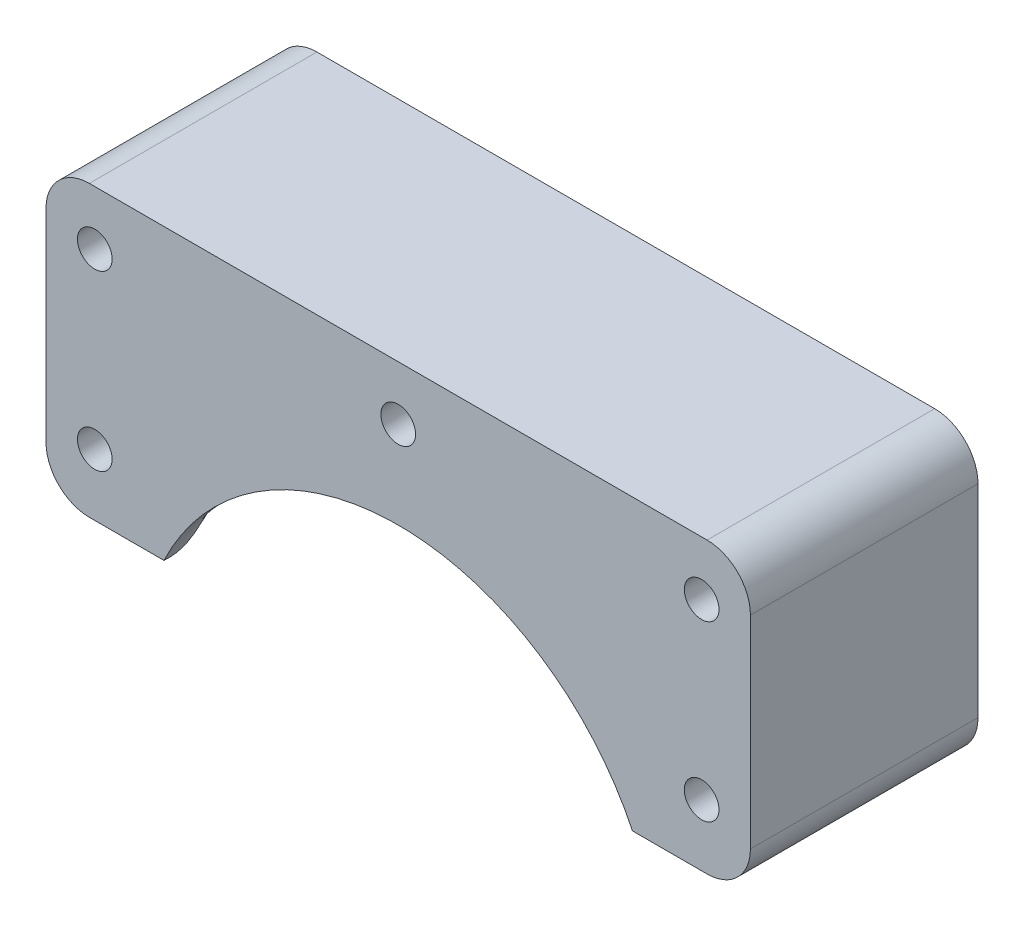
from build123d import *

# Parameters (mm, degrees)
SKETCH1_R                   = 1.6
BOSS_EXTRUDE1_DEPTH         = 10.5
FILLET1_R                   = 4
SKETCH4_R                   = 2.8
CUT_EXTRUDE1_DEPTH          = 5.5
CHAMFER3_SIZE               = 0.6
REVOLUCI_N1_ANGLE           = 67.5
REVOLUCI_N1_OTHER_WAY_ANGLE = 67.5
CORTAR_EXTRUIR3_DEPTH       = 1
CORTAR_EXTRUIR4_DEPTH       = 54.537370165
CORTAR_EXTRUIR4_DEPTH_BACK  = 54.537370165
CROQUIS6_W                  = 49.797106802
CROQUIS6_H                  = 15.102267028


with BuildPart() as part:
    # Sketch1 → Boss-Extrude1 (new, symmetric)
    with BuildSketch(Plane.XY):
        with BuildLine():
            Line((-32.5, 10.313318502), (-24.898553401, 10.313318502))
            ThreePointArc((-24.898553401, 10.313318502), (0, 26.95), (24.898553401, 10.313318502))
            Line((24.898553401, 10.313318502), (32.5, 10.313318502))
            Line((32.5, 10.313318502), (32.5, 37))
            Line((32.5, 37), (-32.5, 37))
            Line((-32.5, 37), (-32.5, 10.313318502))
        make_face()
        with Locations(Location((-28, 16, 0), (0, 0, 180))):
            Circle(SKETCH1_R, mode=Mode.SUBTRACT)
        with Locations(Location((-28, 32, 0), (0, 0, 180))):
            Circle(SKETCH1_R, mode=Mode.SUBTRACT)
        with Locations(Location((28, 16, 0), (0, 0, 180))):
            Circle(SKETCH1_R, mode=Mode.SUBTRACT)
        with Locations(Location((0, 32, 0), (0, 0, 180))):
            Circle(SKETCH1_R, mode=Mode.SUBTRACT)
        with Locations(Location((28, 32, 0), (0, 0, 180))):
            Circle(SKETCH1_R, mode=Mode.SUBTRACT)
    extrude(amount=BOSS_EXTRUDE1_DEPTH, both=True)

    # Fillet1
    fillet1_edges = [part.edges().sort_by_distance(p)[0] for p in [
        (-32.5, 10.313318502, 0),
        (-32.5, 37, 0),
        (32.5, 37, 0),
        (32.5, 10.313318502, 0),
    ]]
    fillet(fillet1_edges, radius=FILLET1_R)

    # Sketch4 → Cut-Extrude1 (cut)
    with BuildSketch(Plane(origin=(0, 0, -10.5), x_dir=(-1, 0, 0), z_dir=(0, 0, -1))):
        with Locations((-28, 32)):
            Circle(SKETCH4_R)
        with Locations((0, 32)):
            Circle(SKETCH4_R)
        with Locations((28, 32)):
            Circle(SKETCH4_R)
        with Locations((-28, 16)):
            Circle(SKETCH4_R)
        with Locations((28, 16)):
            Circle(SKETCH4_R)
    extrude(amount=-CUT_EXTRUDE1_DEPTH, mode=Mode.SUBTRACT)

    # Chamfer3
    chamfer3_edges = [part.edges().sort_by_distance(p)[0] for p in [
        (30.8, 16, -10.5),
        (-25.2, 32, -10.5),
        (2.8, 32, -10.5),
        (30.8, 32, -10.5),
    ]]
    chamfer(chamfer3_edges, length=CHAMFER3_SIZE)

    # Croquis1 → Revolución1 (revolve)
    with BuildSketch(Plane(origin=(0, 0, 0), x_dir=(0, 0, -1), z_dir=(1, 0, 0))):
        with BuildLine():
            Line((10.5, 26.95), (-10.5, 26.95))
            Line((-10.5, 26.95), (-10.5, 23.95))
            add(Edge.make_bspline(
                [(10.5, 23.95), (7.13922955, 23.695558229), (0, 30.004441771), (-7.13922955, 23.695558229), (-10.5, 23.95)],
                knots=[0, 0, 0, 0, 0.5, 1, 1, 1, 1], degree=3))
            Line((10.5, 23.95), (10.5, 26.95))
        make_face()
    revolve(axis=Axis((0, 0, 10.5), (0, 0, -1)), revolution_arc=REVOLUCI_N1_ANGLE)

    # Croquis1 → Revolución1 other way (revolve)
    with BuildSketch(Plane(origin=(0, 0, 0), x_dir=(0, 0, -1), z_dir=(1, 0, 0))):
        with BuildLine():
            Line((10.5, 26.95), (-10.5, 26.95))
            Line((-10.5, 26.95), (-10.5, 23.95))
            add(Edge.make_bspline(
                [(10.5, 23.95), (7.13922955, 23.695558229), (0, 30.004441771), (-7.13922955, 23.695558229), (-10.5, 23.95)],
                knots=[0, 0, 0, 0, 0.5, 1, 1, 1, 1], degree=3))
            Line((10.5, 23.95), (10.5, 26.95))
        make_face()
    revolve(axis=Axis((0, 0, 10.5), (0, 0, 1)), revolution_arc=REVOLUCI_N1_OTHER_WAY_ANGLE)

    # Croquis5 → Cortar-Extruir3 (cut)
    with BuildSketch(Plane(origin=(0, 0, -10.5), x_dir=(-1, 0, 0), z_dir=(0, 0, -1))):
        Polygon((-17.822469022, 29.950787399), (-17.11776149, 29.950787399), (-15.408146105, 25.717454066), (-16.219704599, 25.717454066), (-16.548737719, 26.585830134), (-18.393188841, 26.585830134), (-18.72222196, 25.717454066), (-19.53293243, 25.717454066), align=None)
        Polygon((-17.470539268, 28.815283927), (-18.104860849, 27.345659194), (-16.836217687, 27.345659194), align=None, mode=Mode.SUBTRACT)
    extrude(amount=-CORTAR_EXTRUIR3_DEPTH, mode=Mode.SUBTRACT)

    # Croquis6 → Cortar-Extruir4 (cut, two sides: drawn at the far end of the back side and taken through both)
    with BuildSketch(Plane(origin=(0, 0, -10.5), x_dir=(-1, 0, 0), z_dir=(0, 0, -1)).offset(-CORTAR_EXTRUIR4_DEPTH_BACK)):
        with Locations((0, 2.762184988)):
            Rectangle(CROQUIS6_W, CROQUIS6_H)
    extrude(amount=CORTAR_EXTRUIR4_DEPTH + CORTAR_EXTRUIR4_DEPTH_BACK, mode=Mode.SUBTRACT)


solid = part.part
